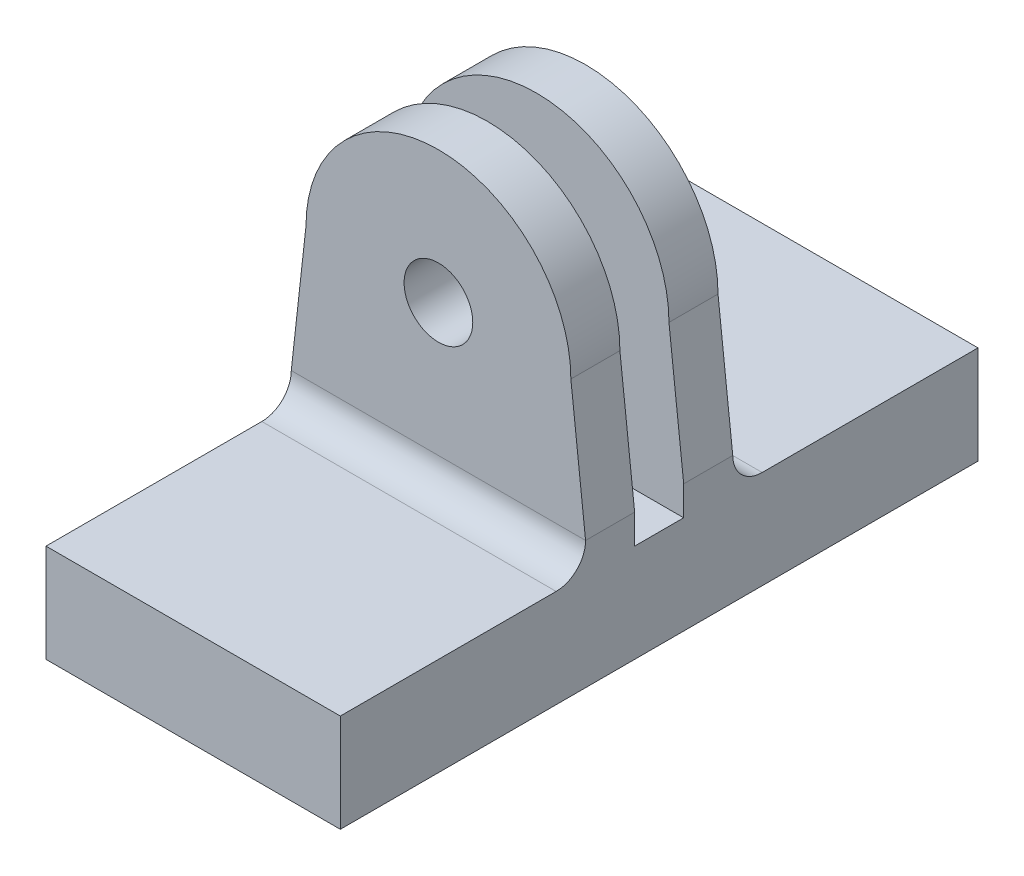
from build123d import *

# Parameters (mm, degrees)
SKETCH2_W           = 30
SKETCH2_H           = 65
BOSS_EXTRUDE1_DEPTH = 10
BOSS_EXTRUDE2_DEPTH = 30
CUT_EXTRUDE1_DEPTH  = 65.031242374
SKETCH6_R           = 3.5
CUT_EXTRUDE2_DEPTH  = 65.031242374


with BuildPart() as part:
    # Sketch2 → Boss-Extrude1 (new body)
    with BuildSketch(Plane(origin=(0, 0, 0), x_dir=(1, 0, 0), z_dir=(0, 1, 0))):
        with Locations((15, 32.5)):
            Rectangle(SKETCH2_W, SKETCH2_H)
    extrude(amount=BOSS_EXTRUDE1_DEPTH)

    # Sketch4 → Boss-Extrude2 (add)
    with BuildSketch(Plane(origin=(30, 0, 0), x_dir=(0, 0, -1), z_dir=(1, 0, 0))):
        with BuildLine():
            Line((30, 10), (30, 40))
            Line((30, 40), (25, 40))
            Line((25, 40), (25, 13))
            ThreePointArc((25, 13), (24.121320344, 10.878679656), (22, 10))
            Line((22, 10), (30, 10))
        make_face()
        with BuildLine():
            Line((43, 10), (35, 10))
            Line((35, 10), (35, 40))
            Line((35, 40), (40, 40))
            Line((40, 40), (40, 13))
            ThreePointArc((40, 13), (40.878679656, 10.878679656), (43, 10))
        make_face()
    extrude(amount=-BOSS_EXTRUDE2_DEPTH)

    # Sketch5 → Cut-Extrude1 (cut, through all)
    with BuildSketch(Plane(origin=(0, 0, -40), x_dir=(-1, 0, 0), z_dir=(0, 0, -1))):
        with BuildLine():
            Line((0, 13), (0, 40))
            Line((0, 40), (0, 41.88167297))
            Line((0, 41.88167297), (-30, 41.88167297))
            Line((-30, 41.88167297), (-30, 40))
            Line((-30, 40), (-30, 13))
            Line((-30, 13), (-28.5, 26.5))
            ThreePointArc((-28.5, 26.5), (-15, 40), (-1.5, 26.5))
            Line((-1.5, 26.5), (0, 13))
        make_face()
    extrude(amount=-CUT_EXTRUDE1_DEPTH, mode=Mode.SUBTRACT)

    # Sketch6 → Cut-Extrude2 (cut, through all)
    with BuildSketch(Plane(origin=(0, 0, -40), x_dir=(-1, 0, 0), z_dir=(0, 0, -1))):
        with Locations((-15, 26.5)):
            Circle(SKETCH6_R)
    extrude(amount=-CUT_EXTRUDE2_DEPTH, mode=Mode.SUBTRACT)


solid = part.part
